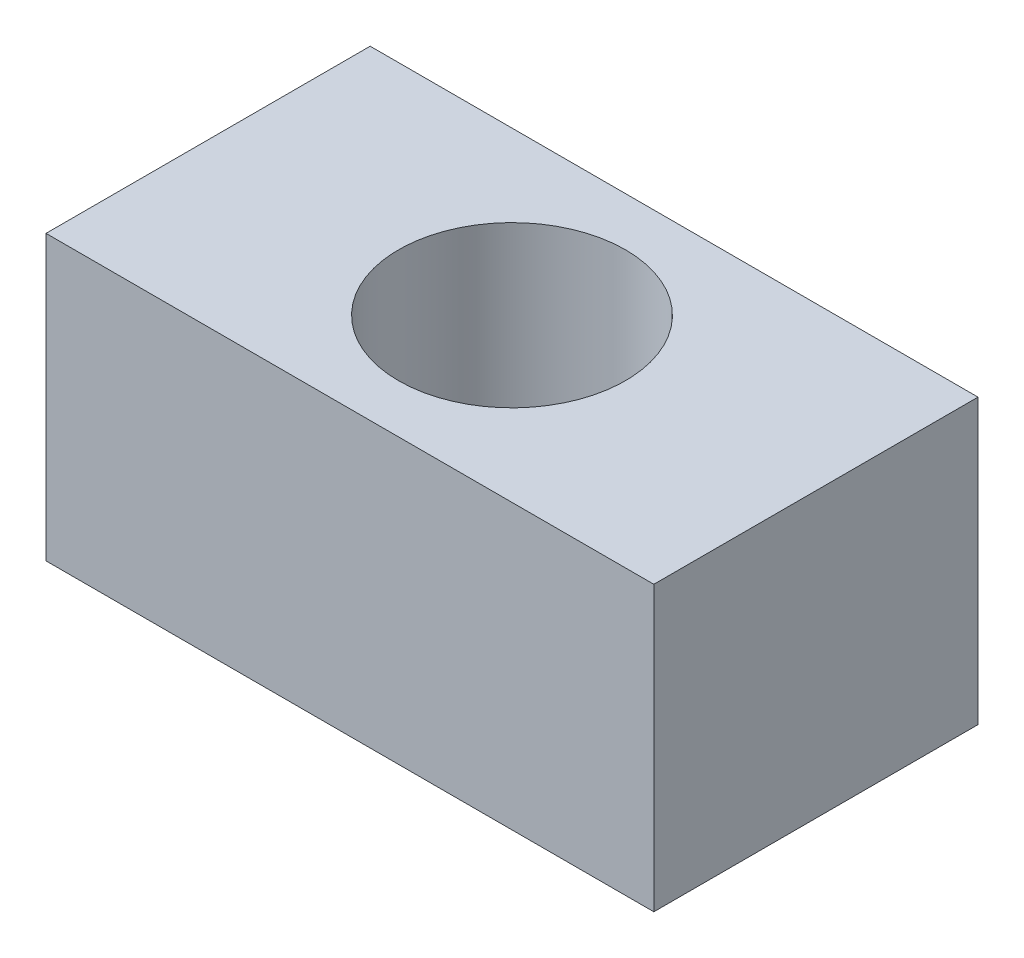
from build123d import *

# Parameters (mm, degrees)
SKETCH1_W           = 75
SKETCH1_H           = 40
BOSS_EXTRUDE2_DEPTH = 35
SKETCH2_R           = 14
CUT_EXTRUDE3_DEPTH  = 35


with BuildPart() as part:
    # Sketch1 → Boss-Extrude2 (new body)
    with BuildSketch(Plane(origin=(0, 0, 0), x_dir=(1, 0, 0), z_dir=(0, 1, 0))):
        with Locations((-15.799878493, -44.333292831)):
            Rectangle(SKETCH1_W, SKETCH1_H)
    extrude(amount=BOSS_EXTRUDE2_DEPTH)

    # Sketch2 → Cut-Extrude3 (cut)
    with BuildSketch(Plane(origin=(0, 0, 0), x_dir=(1, 0, 0), z_dir=(0, 1, 0))):
        with Locations(Location((-15.799878493, -44.333292831, 0), (0, 0, 270))):
            Circle(SKETCH2_R)
    extrude(amount=CUT_EXTRUDE3_DEPTH, mode=Mode.SUBTRACT)


solid = part.part
